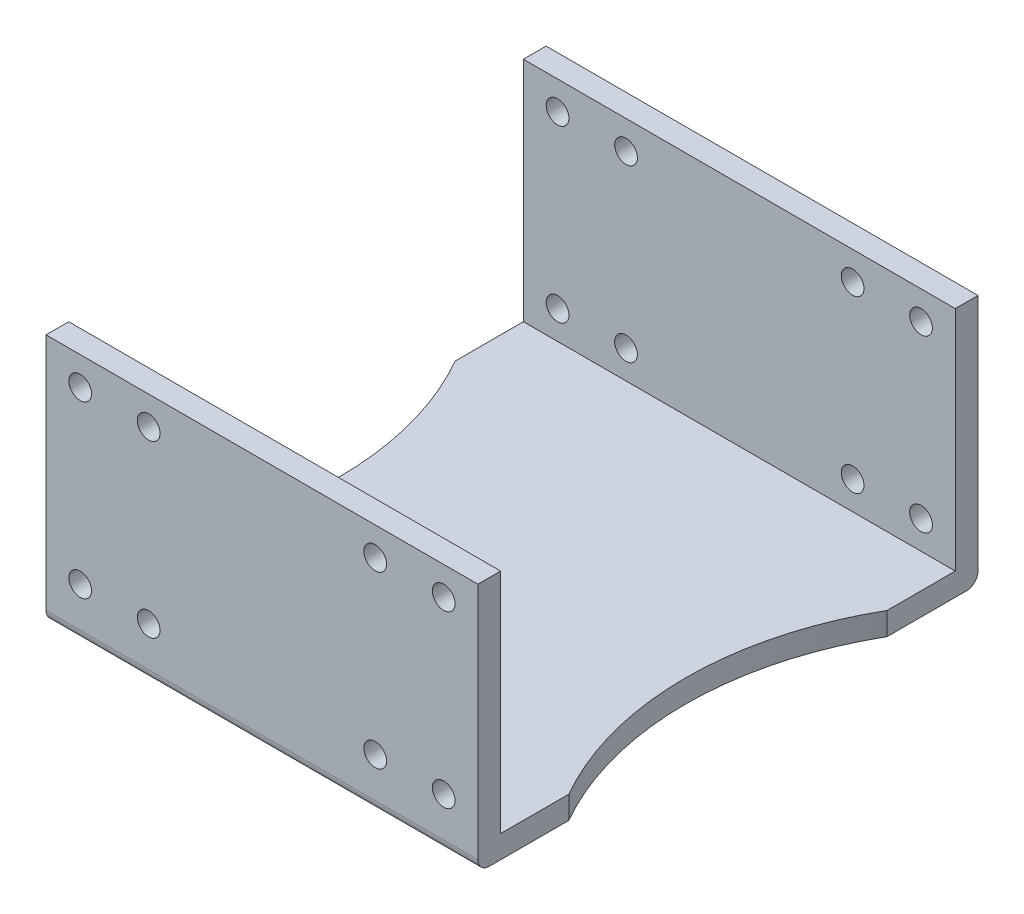
from build123d import *

# Parameters (mm, degrees)
EXTRUDE_1_DEPTH     = 38
CUT_EXTRUDE_1_DEPTH = 38
SKETCH_4_R          = 1
CUT_EXTRUDE_3_DEPTH = 68
FILLET_1_R          = 1


with BuildPart() as part:
    # ｽｹｯﾁ1 → ﾎﾞｽ - 押し出し1 (new body)
    with BuildSketch(Plane(origin=(0, 0, 0), x_dir=(0, 0, -1), z_dir=(1, 0, 0))):
        Polygon((-22, 0), (22, 0), (22, 22), (20, 22), (20, 2), (-20, 2), (-20, 22), (-22, 22), align=None)
    extrude(amount=EXTRUDE_1_DEPTH)

    # ｽｹｯﾁ3 → ｶｯﾄ - 押し出し1 (cut)
    with BuildSketch(Plane(origin=(0, 12, 0), x_dir=(1, 0, 0), z_dir=(0, 1, 0))):
        with BuildLine():
            ThreePointArc((0, 14), (3.728865695, 0), (0, -14))
            Line((0, -14), (0, 14))
        make_face()
        with BuildLine():
            Line((38, 14), (38, -14))
            ThreePointArc((38, -14), (34.271134305, 0), (38, 14))
        make_face()
    extrude(amount=-CUT_EXTRUDE_1_DEPTH, mode=Mode.SUBTRACT)

    # ｽｹｯﾁ4 → ｶｯﾄ - 押し出し3 (cut)
    with BuildSketch(Plane.XY.offset(22)):
        with Locations((3.010351423, 19.5)):
            Circle(SKETCH_4_R)
        with Locations((9.033182751, 19.5)):
            Circle(SKETCH_4_R)
        with Locations(Location((3.010351423, 4.5, 0), (0, 0, 90))):
            Circle(SKETCH_4_R)
        with Locations(Location((9.033182751, 4.5, 0), (0, 0, 90))):
            Circle(SKETCH_4_R)
        with Locations(Location((28.966817249, 19.5, 0), (0, 0, 90))):
            Circle(SKETCH_4_R)
        with Locations(Location((34.989648577, 19.5, 0), (0, 0, 90))):
            Circle(SKETCH_4_R)
        with Locations((34.989648577, 4.5)):
            Circle(SKETCH_4_R)
        with Locations((28.966817249, 4.5)):
            Circle(SKETCH_4_R)
    extrude(amount=-CUT_EXTRUDE_3_DEPTH, mode=Mode.SUBTRACT)

    # ﾌｨﾚｯﾄ1
    fillet_1_edges = [part.edges().sort_by_distance(p)[0] for p in [
        (19, 0, 22),
        (19, 0, -22),
    ]]
    fillet(fillet_1_edges, radius=FILLET_1_R)


solid = part.part
